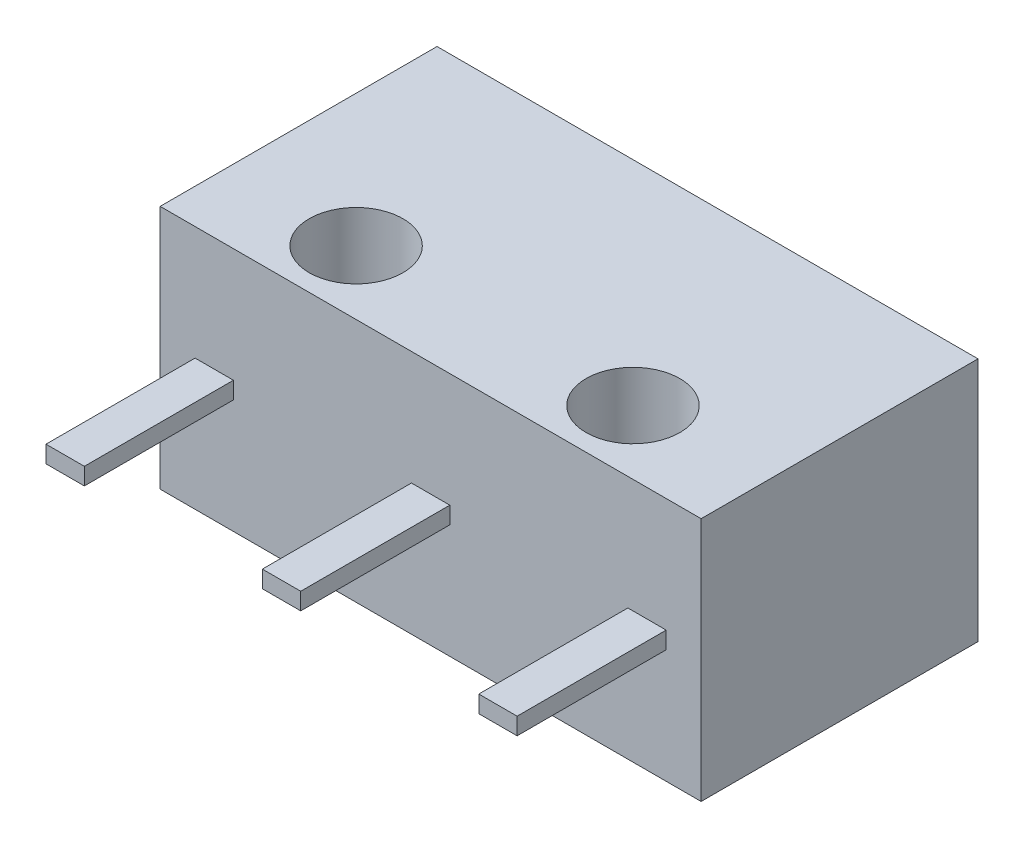
from build123d import *

# Parameters (mm, degrees)
SKETCH1_W                = 12.7
SKETCH1_H                = 6.5
BOSS_EXTRUDE1_DEPTH      = 5.75
SKETCH2_R                = 1.1
CUT_EXTRUDE1_DEPTH       = 16.381888701
BOSS_EXTRUDE2_DEPTH      = 0.2
BOSS_EXTRUDE2_DEPTH_BACK = 0.2
SKETCH3_W                = 0.9
SKETCH3_H                = 3.5
BOSS_EXTRUDE3_DEPTH      = 1.45
BOSS_EXTRUDE3_DEPTH_BACK = 1.45


with BuildPart() as part:
    # Sketch1 → Boss-Extrude1 (new body)
    with BuildSketch(Plane(origin=(0, 0, 0), x_dir=(1, 0, 0), z_dir=(0, 1, 0))):
        with Locations((6.35, 3.25)):
            Rectangle(SKETCH1_W, SKETCH1_H)
    extrude(amount=BOSS_EXTRUDE1_DEPTH)

    # Sketch2 → Cut-Extrude1 (cut, through all)
    with BuildSketch(Plane(origin=(0, 5.75, 0), x_dir=(1, 0, 0), z_dir=(0, 1, 0))):
        with Locations(Location((3.1, 1.5, 0), (0, 0, 270))):
            Circle(SKETCH2_R)
        with Locations(Location((9.6, 1.5, 0), (0, 0, 270))):
            Circle(SKETCH2_R)
    extrude(amount=-CUT_EXTRUDE1_DEPTH, mode=Mode.SUBTRACT)

    # Sketch3 → Boss-Extrude2 (add, two sides: drawn at the far end of the back side and taken through both)
    with BuildSketch(Plane(origin=(0, 2.875, 0), x_dir=(1, 0, 0), z_dir=(0, 1, 0)).offset(-BOSS_EXTRUDE2_DEPTH_BACK)):
        with Locations((6.35, -1.75)):
            Rectangle(SKETCH3_W, SKETCH3_H)
        Polygon((11.88, 0), (11.88, -3.5), (11.43, -3.5), (10.98, -3.5), (10.98, 0), align=None)
        Polygon((0.82, 0), (1.72, 0), (1.72, -3.5), (1.27, -3.5), (0.82, -3.5), align=None)
    extrude(amount=BOSS_EXTRUDE2_DEPTH + BOSS_EXTRUDE2_DEPTH_BACK)

    # Sketch4 → Boss-Extrude3 (add, two sides: drawn at the far end of the back side and taken through both)
    with BuildSketch(Plane(origin=(0, 2.875, 0), x_dir=(1, 0, 0), z_dir=(0, 1, 0)).offset(-BOSS_EXTRUDE3_DEPTH_BACK)):
        with BuildLine():
            Line((3.8, 6.5), (5, 6.5))
            ThreePointArc((5, 6.5), (4.4, 7.1), (3.8, 6.5))
        make_face()
    extrude(amount=BOSS_EXTRUDE3_DEPTH + BOSS_EXTRUDE3_DEPTH_BACK)


solid = part.part
